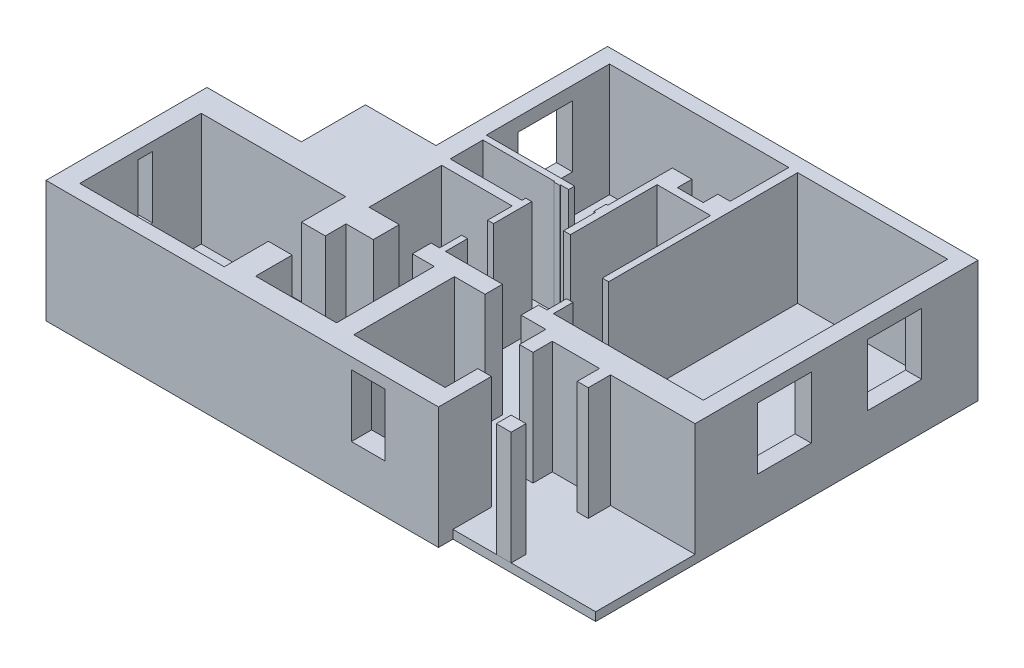
from build123d import *

# Parameters (mm, degrees)
EXTRUDE_1_DEPTH     = 2665
SKETCH_1_W          = 350
SKETCH_1_H          = 350
EXTRUDE_1_2_DEPTH   = 2665
EXTRUDE_2_DEPTH     = 200
SKETCH_3_W          = 1270
SKETCH_3_H          = 1450
SKETCH_3_W_2        = 1280
CUT_EXTRUDE_1_DEPTH = 380
SKETCH_4_W          = 1280
SKETCH_4_H          = 1450
CUT_EXTRUDE_2_DEPTH = 380
SKETCH_5_W          = 346.615664156
SKETCH_5_H          = 1460
CUT_EXTRUDE_3_DEPTH = 460
SKETCH_6_W          = 790
SKETCH_6_H          = 1465
CUT_EXTRUDE_4_DEPTH = 475


with BuildPart() as part:
    # Эскиз1 → Бобышка-Вытянуть1 (new body)
    with BuildSketch(Plane(origin=(0, 0, 0), x_dir=(1, 0, 0), z_dir=(0, 1, 0))):
        Polygon((0, 0), (4220, 0), (4220, -1380), (3930, -1380), (3930, -1722.294402301), (3320, -1722.294402301), (3320, -1380), (2860, -1380), (2860, -2900), (2820, -2900), (2820, -3185.644376016), (2860, -3185.644376016), (2860, -3940), (3020, -3940), (3020, -1900.028681712), (4280, -1900.028681712), (4280, -4450), (4430, -4450), (4430, 0), (7960, 0), (7960, -5750), (4430, -5750), (4430, -5290), (4280, -5290), (4280, -5750), (4080, -5750), (4080, -6160), (4660, -6160), (4660, -6780), (4980, -6780), (4980, -6325), (6090, -6325), (6090, -6850), (6350, -6850), (6350, -6325), (8340, -6325), (8340, 335), (-380, 335), (-380, -3705), (-2040, -3705), (-2040, -5215), (-4260, -5215), (-4260, -9005), (4980, -9005), (4980, -7760), (4660, -7760), (4660, -8530), (2510, -8530), (2510, -6160), (3230, -6160), (3230, -5750), (1890, -5750), (1890, -5230), (1750, -5230), (1750, -5750), (1550, -5750), (1550, -6190), (2065, -6190), (2065, -8490), (160, -8490), (160, -7630), (-400, -7630), (-400, -8670), (-3800, -8670), (-3800, -5810), (-400, -5810), (-400, -6850), (160, -6850), (160, -6360), (723.669572164, -6360), (800, -6360), (800, -5750), (90, -5750), (90, -4040), (1750, -4040), (1750, -4620), (1890, -4620), (1890, -3720), (1750, -3720), (1750, -3810), (60, -3810), (60, -3040), (1750, -3040), (1750, -3060), (1890, -3060), (1890, -3040), (2080, -3040), (2080, -2900), (0, -2900), align=None)
    extrude(amount=EXTRUDE_1_DEPTH)

    # Эскиз2 → Бобышка-Вытянуть2 (add)
    with BuildSketch(Plane.XZ):
        Polygon((-4260, 5215), (-4260, 9005), (4980, 9005), (4980, 8665), (8340, 8665), (8340, -335), (-380, -335), (-380, 3705), (-2040, 3705), (-2040, 5215), align=None)
    extrude(amount=EXTRUDE_2_DEPTH)

    # Эскиз3 → Вырез-Вытянуть1 (cut)
    with BuildSketch(Plane(origin=(8340, 0, 0), x_dir=(0, 0, -1), z_dir=(1, 0, 0))):
        with Locations((-4225, 1625)):
            Rectangle(SKETCH_3_W, SKETCH_3_H)
        with Locations((-1630, 1625)):
            Rectangle(SKETCH_3_W_2, SKETCH_3_H)
    extrude(amount=-CUT_EXTRUDE_1_DEPTH, mode=Mode.SUBTRACT)

    # Эскиз4 → Вырез-Вытянуть2 (cut)
    with BuildSketch(Plane.ZY.offset(380)):
        with Locations((1510, 1625)):
            Rectangle(SKETCH_4_W, SKETCH_4_H)
    extrude(amount=-CUT_EXTRUDE_2_DEPTH, mode=Mode.SUBTRACT)

    # Эскиз5 → Вырез-Вытянуть3 (cut)
    with BuildSketch(Plane.ZY.offset(4260)):
        with Locations((7127.624496434, 1730)):
            Rectangle(SKETCH_5_W, SKETCH_5_H)
    extrude(amount=-CUT_EXTRUDE_3_DEPTH, mode=Mode.SUBTRACT)

    # Эскиз6 → Вырез-Вытянуть4 (cut)
    with BuildSketch(Plane.XY.offset(9005)):
        with Locations((3325, 1667.5)):
            Rectangle(SKETCH_6_W, SKETCH_6_H)
    extrude(amount=-CUT_EXTRUDE_4_DEPTH, mode=Mode.SUBTRACT)


with BuildPart() as body_2:
    # Эскиз1 → Extrude 1 2 (new body)
    with BuildSketch(Plane(origin=(0, 0, 0), x_dir=(1, 0, 0), z_dir=(0, 1, 0))):
        with Locations((6175, -8490)):
            Rectangle(SKETCH_1_W, SKETCH_1_H)
    extrude(amount=EXTRUDE_1_2_DEPTH)


solid = Compound([part.part, body_2.part])
